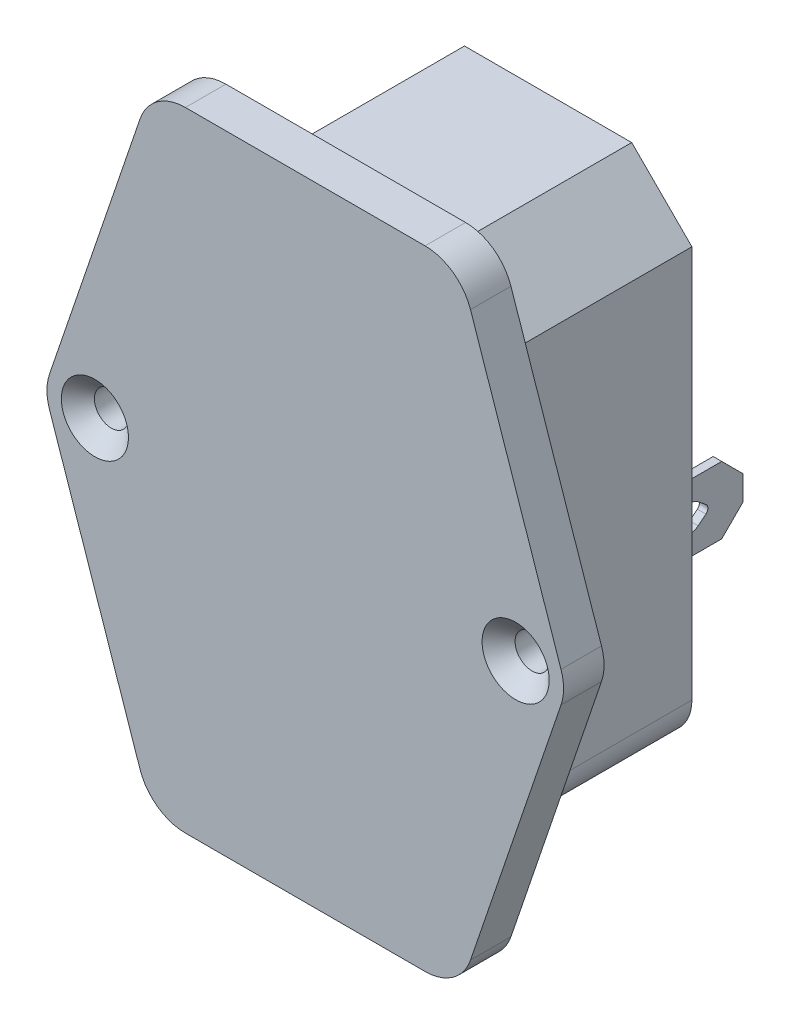
from build123d import *

# Parameters (mm, degrees)
SKETCH1_W                                       = 27
SKETCH1_H                                       = 46.5
BOSS_EXTRUDE1_DEPTH                             = 19
SKETCH2_R                                       = 1.6
BOSS_EXTRUDE2_DEPTH                             = 3.8
CSK_FOR_M3_FLAT_HEAD_MACHINE_SCREW1_D           = 3.2
CSK_FOR_M3_FLAT_HEAD_MACHINE_SCREW1_CSINK_D     = 6.3
CSK_FOR_M3_FLAT_HEAD_MACHINE_SCREW1_CSINK_ANGLE = 90
SKETCH5_W                                       = 5.5
SKETCH5_H                                       = 9.3
BOSS_EXTRUDE3_DEPTH                             = 2.5
BOSS_EXTRUDE4_DEPTH                             = 0.8
CHAMFER1_SIZE                                   = 2
FILLET1_R                                       = 0.5
SKETCH7_W                                       = 9
SKETCH7_H                                       = 6.3
BOSS_EXTRUDE5_DEPTH                             = 0.8
CHAMFER2_SIZE                                   = 2
FILLET3_R                                       = 0.5
CHAMFER3_SIZE                                   = 5.65
FILLET2_R                                       = 4


with BuildPart() as part:
    # Sketch1 → Boss-Extrude1 (new body)
    with BuildSketch(Plane.XY):
        with Locations((13.5, 23.25)):
            Rectangle(SKETCH1_W, SKETCH1_H)
    extrude(amount=BOSS_EXTRUDE1_DEPTH)

    # Sketch2 → Boss-Extrude2 (add)
    with BuildSketch(Plane.XY.offset(19)):
        with BuildLine():
            Line((2.25, -7.8), (24.75, -7.8))
            ThreePointArc((24.75, -7.8), (27.370254725, -6.958451199), (29.010477352, -4.7485623))
            Line((29.010477352, -4.7485623), (37.510477352, 20.2514377))
            ThreePointArc((37.510477352, 20.2514377), (37.75, 21.7), (37.510477352, 23.1485623))
            Line((37.510477352, 23.1485623), (29.010477352, 48.1485623))
            ThreePointArc((29.010477352, 48.1485623), (27.370254725, 50.358451199), (24.75, 51.2))
            Line((24.75, 51.2), (2.25, 51.2))
            ThreePointArc((2.25, 51.2), (-0.370254725, 50.358451199), (-2.010477352, 48.1485623))
            Line((-2.010477352, 48.1485623), (-10.510477352, 23.1485623))
            ThreePointArc((-10.510477352, 23.1485623), (-10.75, 21.7), (-10.510477352, 20.2514377))
            Line((-10.510477352, 20.2514377), (-2.010477352, -4.7485623))
            ThreePointArc((-2.010477352, -4.7485623), (-0.370254725, -6.958451199), (2.25, -7.8))
        make_face()
        with Locations(Location((-6.25, 21.7, 0), (0, 0, 180))):
            Circle(SKETCH2_R, mode=Mode.SUBTRACT)
        with Locations(Location((33.25, 21.7, 0), (0, 0, 180))):
            Circle(SKETCH2_R, mode=Mode.SUBTRACT)
    extrude(amount=BOSS_EXTRUDE2_DEPTH)

    # CSK for M3 Flat Head Machine Screw1 (through all)
    with Locations(Plane.XY.offset(22.8)):
        with Locations((-6.25, 21.7), (33.25, 21.7)):
            CounterSinkHole(CSK_FOR_M3_FLAT_HEAD_MACHINE_SCREW1_D / 2, CSK_FOR_M3_FLAT_HEAD_MACHINE_SCREW1_CSINK_D / 2, counter_sink_angle=CSK_FOR_M3_FLAT_HEAD_MACHINE_SCREW1_CSINK_ANGLE)

    # Sketch5 → Boss-Extrude3 (add)
    with BuildSketch(Plane(origin=(0, 0, 0), x_dir=(-1, 0, 0), z_dir=(0, 0, -1))):
        with Locations((-19.85, 12.15)):
            Rectangle(SKETCH5_W, SKETCH5_H)
        with Locations((-7.15, 12.15)):
            Rectangle(SKETCH5_W, SKETCH5_H)
    extrude(amount=BOSS_EXTRUDE3_DEPTH)

    # Chamfer3
    chamfer3_edges = [part.edges().sort_by_distance(p)[0] for p in [
        (0, 46.5, 9.5),
        (27, 46.5, 9.5),
    ]]
    chamfer(chamfer3_edges, length=CHAMFER3_SIZE)

    # Fillet2
    fillet2_edges = [part.edges().sort_by_distance(p)[0] for p in [
        (27, 0, 9.5),
        (0, 0, 9.5),
    ]]
    fillet(fillet2_edges, radius=FILLET2_R)


with BuildPart() as body_2:
    # Sketch6 → Boss-Extrude4 (new body)
    with BuildSketch(Plane(origin=(0, 5, 0), x_dir=(-1, 0, 0), z_dir=(0, -1, 0))):
        Polygon((-17.435, 0), (-17.435, 2.87), (-16.65, 2.87), (-16.65, 11.5), (-10.35, 11.5), (-10.35, 2.87), (-9.565, 2.87), (-9.565, 0), align=None)
        with BuildLine():
            Line((-13.5, 8.5), (-14.475780937, 7.28125))
            ThreePointArc((-14.475780937, 7.28125), (-13.5, 5.25), (-12.524219063, 7.28125))
            Line((-12.524219063, 7.28125), (-13.5, 8.5))
        make_face(mode=Mode.SUBTRACT)
    extrude(amount=BOSS_EXTRUDE4_DEPTH)

    # Chamfer1
    chamfer1_edges = [body_2.edges().sort_by_distance(p)[0] for p in [
        (16.65, 4.6, -11.5),
        (10.35, 4.6, -11.5),
    ]]
    chamfer(chamfer1_edges, length=CHAMFER1_SIZE)

    # Fillet1
    fillet1_edges = [body_2.edges().sort_by_distance(p)[0] for p in [
        (13.5, 4.6, -8.5),
    ]]
    fillet(fillet1_edges, radius=FILLET1_R)


with BuildPart() as body_3:
    # Sketch7 → Boss-Extrude5 (new body)
    with BuildSketch(Plane(origin=(19.5, 0, 0), x_dir=(0, 0, -1), z_dir=(1, 0, 0))):
        with Locations((7, 12.15)):
            Rectangle(SKETCH7_W, SKETCH7_H)
        with BuildLine():
            Line((7.28125, 13.125780937), (8.5, 12.15))
            Line((8.5, 12.15), (7.28125, 11.174219063))
            ThreePointArc((7.28125, 11.174219063), (5.25, 12.15), (7.28125, 13.125780937))
        make_face(mode=Mode.SUBTRACT)
    extrude(amount=BOSS_EXTRUDE5_DEPTH)

    # Chamfer2
    chamfer2_edges = [body_3.edges().sort_by_distance(p)[0] for p in [
        (19.9, 15.3, -11.5),
        (19.9, 9, -11.5),
    ]]
    chamfer(chamfer2_edges, length=CHAMFER2_SIZE)

    # Fillet3
    fillet3_edges = [body_3.edges().sort_by_distance(p)[0] for p in [
        (19.9, 12.15, -8.5),
    ]]
    fillet(fillet3_edges, radius=FILLET3_R)


with BuildPart() as body_4:
    # Mirror2: mirrored copy
    add(body_3.part.mirror(Plane(origin=(13.5, 0, 0), x_dir=(0, 0, 1), z_dir=(1, 0, 0))))


solid = Compound([part.part, body_2.part, body_3.part, body_4.part])
